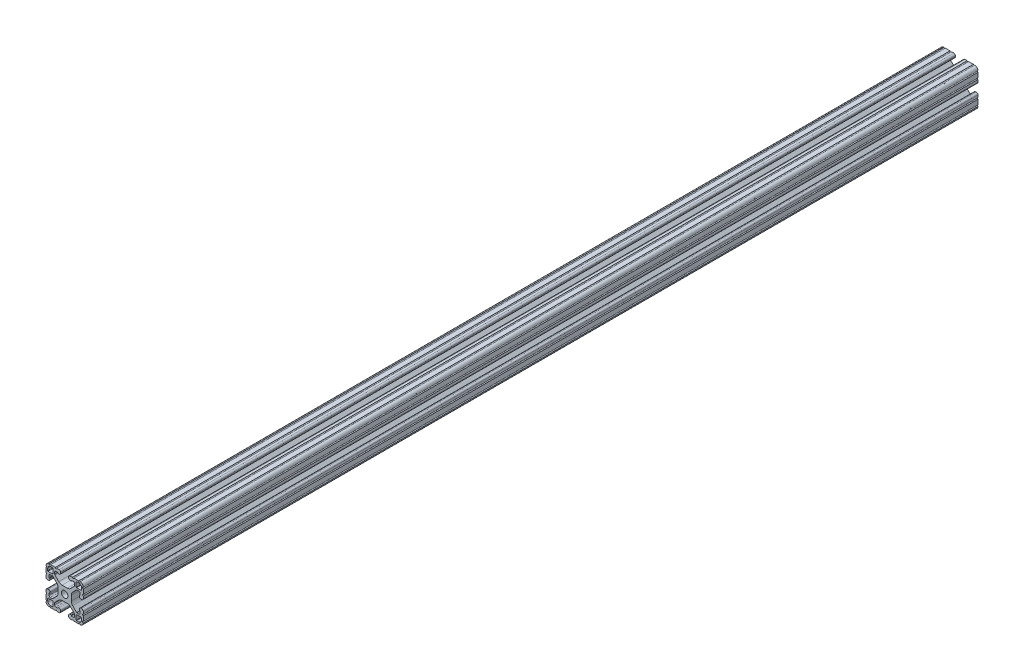
from build123d import *

# Parameters (mm, degrees)
SKETCH1_R           = 3.3274
BOSS_EXTRUDE1_DEPTH = 457.2


with BuildPart() as part:
    # Sketch1 → Boss-Extrude1 (new, symmetric)
    with BuildSketch(Plane.XY):
        with BuildLine():
            Line((-10.02670034, 12.151875049), (-6.021451835, 8.147301292))
            ThreePointArc((-6.021451835, 8.147301292), (-4.48060392, 7.11788044), (-2.663118988, 6.7564))
            Line((-2.663118988, 6.7564), (2.663118988, 6.7564))
            ThreePointArc((2.663118988, 6.7564), (4.48060392, 7.11788044), (6.021451835, 8.147301292))
            Line((6.021451835, 8.147301292), (10.02670034, 12.151875049))
            ThreePointArc((10.02670034, 12.151875049), (10.219349756, 12.440155844), (10.287, 12.78021916))
            Line((10.287, 12.78021916), (10.287, 14.55471092))
            ThreePointArc((10.287, 14.55471092), (9.915025612, 15.452736532), (9.017, 15.82471092))
            Line((9.017, 15.82471092), (6.814144259, 15.82471092))
            Line((6.814144259, 15.82471092), (6.814144259, 14.986))
            Line((6.814144259, 14.986), (5.6388, 14.986))
            ThreePointArc((5.6388, 14.986), (4.525248241, 15.447248241), (4.064, 16.5608))
            Line((4.064, 16.5608), (4.064, 17.4752))
            ThreePointArc((4.064, 17.4752), (4.525248241, 18.588751759), (5.6388, 19.05))
            Line((5.6388, 19.05), (7.9756, 19.05))
            ThreePointArc((7.9756, 19.05), (8.7376, 18.288), (9.4996, 19.05))
            Line((9.4996, 19.05), (14.3256, 19.05))
            ThreePointArc((14.3256, 19.05), (15.0876, 18.288), (15.8496, 19.05))
            Line((15.8496, 19.05), (15.875, 19.05))
            ThreePointArc((15.875, 19.05), (18.12006403, 18.12006403), (19.05, 15.875))
            Line((19.05, 15.875), (19.05, 15.8496))
            ThreePointArc((19.05, 15.8496), (18.288, 15.0876), (19.05, 14.3256))
            Line((19.05, 14.3256), (19.05, 9.4996))
            ThreePointArc((19.05, 9.4996), (18.288, 8.7376), (19.05, 7.9756))
            Line((19.05, 7.9756), (19.05, 5.6388))
            ThreePointArc((19.05, 5.6388), (18.588751759, 4.525248241), (17.4752, 4.064))
            Line((17.4752, 4.064), (16.5608, 4.064))
            ThreePointArc((16.5608, 4.064), (15.447248241, 4.525248241), (14.986, 5.6388))
            Line((14.986, 5.6388), (14.986, 6.750644259))
            Line((14.986, 6.750644259), (15.879033733, 6.750644259))
            Line((15.879033733, 6.750644259), (15.879033733, 8.919211783))
            ThreePointArc((15.879033733, 8.919211783), (15.507059345, 9.817237395), (14.609033733, 10.189211783))
            Line((14.609033733, 10.189211783), (12.742784468, 10.189211783))
            ThreePointArc((12.742784468, 10.189211783), (12.402613491, 10.121555016), (12.114219497, 9.928882664))
            Line((12.114219497, 9.928882664), (8.147867153, 5.963198517))
            ThreePointArc((8.147867153, 5.963198517), (7.118033561, 4.422154408), (6.7564, 2.604299809))
            Line((6.7564, 2.604299809), (6.7564, -2.604299809))
            ThreePointArc((6.7564, -2.604299809), (7.118033561, -4.422154408), (8.147867153, -5.963198517))
            Line((8.147867153, -5.963198517), (12.114219497, -9.928882664))
            ThreePointArc((12.114219497, -9.928882664), (12.402613491, -10.121555016), (12.742784468, -10.189211783))
            Line((12.742784468, -10.189211783), (14.609033733, -10.189211783))
            ThreePointArc((14.609033733, -10.189211783), (15.507059345, -9.817237395), (15.879033733, -8.919211783))
            Line((15.879033733, -8.919211783), (15.879033733, -6.750644259))
            Line((15.879033733, -6.750644259), (14.986, -6.750644259))
            Line((14.986, -6.750644259), (14.986, -5.6388))
            ThreePointArc((14.986, -5.6388), (15.447248241, -4.525248241), (16.5608, -4.064))
            Line((16.5608, -4.064), (17.4752, -4.064))
            ThreePointArc((17.4752, -4.064), (18.588751759, -4.525248241), (19.05, -5.6388))
            Line((19.05, -5.6388), (19.05, -7.9756))
            ThreePointArc((19.05, -7.9756), (18.288, -8.7376), (19.05, -9.4996))
            Line((19.05, -9.4996), (19.05, -14.3256))
            ThreePointArc((19.05, -14.3256), (18.288, -15.0876), (19.05, -15.8496))
            Line((19.05, -15.8496), (19.05, -15.875))
            ThreePointArc((19.05, -15.875), (18.12006403, -18.12006403), (15.875, -19.05))
            Line((15.875, -19.05), (15.8496, -19.05))
            ThreePointArc((15.8496, -19.05), (15.0876, -18.288), (14.3256, -19.05))
            Line((14.3256, -19.05), (9.4996, -19.05))
            ThreePointArc((9.4996, -19.05), (8.7376, -18.288), (7.9756, -19.05))
            Line((7.9756, -19.05), (5.6388, -19.05))
            ThreePointArc((5.6388, -19.05), (4.525248241, -18.588751759), (4.064, -17.4752))
            Line((4.064, -17.4752), (4.064, -16.5608))
            ThreePointArc((4.064, -16.5608), (4.525248241, -15.447248241), (5.6388, -14.986))
            Line((5.6388, -14.986), (6.814144259, -14.986))
            Line((6.814144259, -14.986), (6.814144259, -15.82471092))
            Line((6.814144259, -15.82471092), (9.017, -15.82471092))
            ThreePointArc((9.017, -15.82471092), (9.915025612, -15.452736532), (10.287, -14.55471092))
            Line((10.287, -14.55471092), (10.287, -12.78021916))
            ThreePointArc((10.287, -12.78021916), (10.219349756, -12.440155844), (10.02670034, -12.151875049))
            Line((10.02670034, -12.151875049), (6.021451835, -8.147301292))
            ThreePointArc((6.021451835, -8.147301292), (4.48060392, -7.11788044), (2.663118988, -6.7564))
            Line((2.663118988, -6.7564), (-2.663118988, -6.7564))
            ThreePointArc((-2.663118988, -6.7564), (-4.48060392, -7.11788044), (-6.021451835, -8.147301292))
            Line((-6.021451835, -8.147301292), (-10.02670034, -12.151875049))
            ThreePointArc((-10.02670034, -12.151875049), (-10.219349756, -12.440155844), (-10.287, -12.78021916))
            Line((-10.287, -12.78021916), (-10.287, -14.55471092))
            ThreePointArc((-10.287, -14.55471092), (-9.915025612, -15.452736532), (-9.017, -15.82471092))
            Line((-9.017, -15.82471092), (-6.814144259, -15.82471092))
            Line((-6.814144259, -15.82471092), (-6.814144259, -14.986))
            Line((-6.814144259, -14.986), (-5.6388, -14.986))
            ThreePointArc((-5.6388, -14.986), (-4.525248241, -15.447248241), (-4.064, -16.5608))
            Line((-4.064, -16.5608), (-4.064, -17.4752))
            ThreePointArc((-4.064, -17.4752), (-4.525248241, -18.588751759), (-5.6388, -19.05))
            Line((-5.6388, -19.05), (-7.9756, -19.05))
            ThreePointArc((-7.9756, -19.05), (-8.7376, -18.288), (-9.4996, -19.05))
            Line((-9.4996, -19.05), (-14.3256, -19.05))
            ThreePointArc((-14.3256, -19.05), (-15.0876, -18.288), (-15.8496, -19.05))
            Line((-15.8496, -19.05), (-15.875, -19.05))
            ThreePointArc((-15.875, -19.05), (-18.12006403, -18.12006403), (-19.05, -15.875))
            Line((-19.05, -15.875), (-19.05, -15.8496))
            ThreePointArc((-19.05, -15.8496), (-18.288, -15.0876), (-19.05, -14.3256))
            Line((-19.05, -14.3256), (-19.05, -9.4996))
            ThreePointArc((-19.05, -9.4996), (-18.288, -8.7376), (-19.05, -7.9756))
            Line((-19.05, -7.9756), (-19.05, -5.6388))
            ThreePointArc((-19.05, -5.6388), (-18.588751759, -4.525248241), (-17.4752, -4.064))
            Line((-17.4752, -4.064), (-16.5608, -4.064))
            ThreePointArc((-16.5608, -4.064), (-15.447248241, -4.525248241), (-14.986, -5.6388))
            Line((-14.986, -5.6388), (-14.986, -6.750644259))
            Line((-14.986, -6.750644259), (-15.879033733, -6.750644259))
            Line((-15.879033733, -6.750644259), (-15.879033733, -8.919211783))
            ThreePointArc((-15.879033733, -8.919211783), (-15.507059345, -9.817237395), (-14.609033733, -10.189211783))
            Line((-14.609033733, -10.189211783), (-12.742784468, -10.189211783))
            ThreePointArc((-12.742784468, -10.189211783), (-12.402613491, -10.121555016), (-12.114219497, -9.928882664))
            Line((-12.114219497, -9.928882664), (-8.147867153, -5.963198517))
            ThreePointArc((-8.147867153, -5.963198517), (-7.118033561, -4.422154408), (-6.7564, -2.604299809))
            Line((-6.7564, -2.604299809), (-6.7564, 2.604299809))
            ThreePointArc((-6.7564, 2.604299809), (-7.118033561, 4.422154408), (-8.147867153, 5.963198517))
            Line((-8.147867153, 5.963198517), (-12.114219497, 9.928882664))
            ThreePointArc((-12.114219497, 9.928882664), (-12.402613491, 10.121555016), (-12.742784468, 10.189211783))
            Line((-12.742784468, 10.189211783), (-14.609033733, 10.189211783))
            ThreePointArc((-14.609033733, 10.189211783), (-15.507059345, 9.817237395), (-15.879033733, 8.919211783))
            Line((-15.879033733, 8.919211783), (-15.879033733, 6.750644259))
            Line((-15.879033733, 6.750644259), (-14.986, 6.750644259))
            Line((-14.986, 6.750644259), (-14.986, 5.6388))
            ThreePointArc((-14.986, 5.6388), (-15.447248241, 4.525248241), (-16.5608, 4.064))
            Line((-16.5608, 4.064), (-17.4752, 4.064))
            ThreePointArc((-17.4752, 4.064), (-18.588751759, 4.525248241), (-19.05, 5.6388))
            Line((-19.05, 5.6388), (-19.05, 7.9756))
            ThreePointArc((-19.05, 7.9756), (-18.288, 8.7376), (-19.05, 9.4996))
            Line((-19.05, 9.4996), (-19.05, 14.3256))
            ThreePointArc((-19.05, 14.3256), (-18.288, 15.0876), (-19.05, 15.8496))
            Line((-19.05, 15.8496), (-19.05, 15.875))
            ThreePointArc((-19.05, 15.875), (-18.12006403, 18.12006403), (-15.875, 19.05))
            Line((-15.875, 19.05), (-15.8496, 19.05))
            ThreePointArc((-15.8496, 19.05), (-15.0876, 18.288), (-14.3256, 19.05))
            Line((-14.3256, 19.05), (-9.4996, 19.05))
            ThreePointArc((-9.4996, 19.05), (-8.7376, 18.288), (-7.9756, 19.05))
            Line((-7.9756, 19.05), (-5.6388, 19.05))
            ThreePointArc((-5.6388, 19.05), (-4.525248241, 18.588751759), (-4.064, 17.4752))
            Line((-4.064, 17.4752), (-4.064, 16.5608))
            ThreePointArc((-4.064, 16.5608), (-4.525248241, 15.447248241), (-5.6388, 14.986))
            Line((-5.6388, 14.986), (-6.814144259, 14.986))
            Line((-6.814144259, 14.986), (-6.814144259, 15.82471092))
            Line((-6.814144259, 15.82471092), (-9.017, 15.82471092))
            ThreePointArc((-9.017, 15.82471092), (-9.915025612, 15.452736532), (-10.287, 14.55471092))
            Line((-10.287, 14.55471092), (-10.287, 12.78021916))
            ThreePointArc((-10.287, 12.78021916), (-10.219349756, 12.440155844), (-10.02670034, 12.151875049))
        make_face()
        with Locations(Location((0, 0, 0), (0, 0, 180))):
            Circle(SKETCH1_R, mode=Mode.SUBTRACT)
        with BuildLine():
            Line((-16.891, 11.8618), (-12.2428, 11.8618))
            ThreePointArc((-12.2428, 11.8618), (-11.973392316, 11.973392316), (-11.8618, 12.2428))
            Line((-11.8618, 12.2428), (-11.8618, 16.891))
            ThreePointArc((-11.8618, 16.891), (-11.973392316, 17.160407684), (-12.2428, 17.272))
            Line((-12.2428, 17.272), (-14.478, 17.272))
            ThreePointArc((-14.478, 17.272), (-16.453656347, 16.453656347), (-17.272, 14.478))
            Line((-17.272, 14.478), (-17.272, 12.2428))
            ThreePointArc((-17.272, 12.2428), (-17.160407684, 11.973392316), (-16.891, 11.8618))
        make_face(mode=Mode.SUBTRACT)
        with BuildLine():
            Line((-17.272, -14.478), (-17.272, -12.2428))
            ThreePointArc((-17.272, -12.2428), (-17.160407684, -11.973392316), (-16.891, -11.8618))
            Line((-16.891, -11.8618), (-12.2428, -11.8618))
            ThreePointArc((-12.2428, -11.8618), (-11.973392316, -11.973392316), (-11.8618, -12.2428))
            Line((-11.8618, -12.2428), (-11.8618, -16.891))
            ThreePointArc((-11.8618, -16.891), (-11.973392316, -17.160407684), (-12.2428, -17.272))
            Line((-12.2428, -17.272), (-14.478, -17.272))
            ThreePointArc((-14.478, -17.272), (-16.453656347, -16.453656347), (-17.272, -14.478))
        make_face(mode=Mode.SUBTRACT)
        with BuildLine():
            Line((17.272, 14.478), (17.272, 12.2428))
            ThreePointArc((17.272, 12.2428), (17.160407684, 11.973392316), (16.891, 11.8618))
            Line((16.891, 11.8618), (12.2428, 11.8618))
            ThreePointArc((12.2428, 11.8618), (11.973392316, 11.973392316), (11.8618, 12.2428))
            Line((11.8618, 12.2428), (11.8618, 16.891))
            ThreePointArc((11.8618, 16.891), (11.973392316, 17.160407684), (12.2428, 17.272))
            Line((12.2428, 17.272), (14.478, 17.272))
            ThreePointArc((14.478, 17.272), (16.453656347, 16.453656347), (17.272, 14.478))
        make_face(mode=Mode.SUBTRACT)
        with BuildLine():
            Line((16.891, -11.8618), (12.2428, -11.8618))
            ThreePointArc((12.2428, -11.8618), (11.973392316, -11.973392316), (11.8618, -12.2428))
            Line((11.8618, -12.2428), (11.8618, -16.891))
            ThreePointArc((11.8618, -16.891), (11.973392316, -17.160407684), (12.2428, -17.272))
            Line((12.2428, -17.272), (14.478, -17.272))
            ThreePointArc((14.478, -17.272), (16.453656347, -16.453656347), (17.272, -14.478))
            Line((17.272, -14.478), (17.272, -12.2428))
            ThreePointArc((17.272, -12.2428), (17.160407684, -11.973392316), (16.891, -11.8618))
        make_face(mode=Mode.SUBTRACT)
    extrude(amount=BOSS_EXTRUDE1_DEPTH, both=True)


solid = part.part
